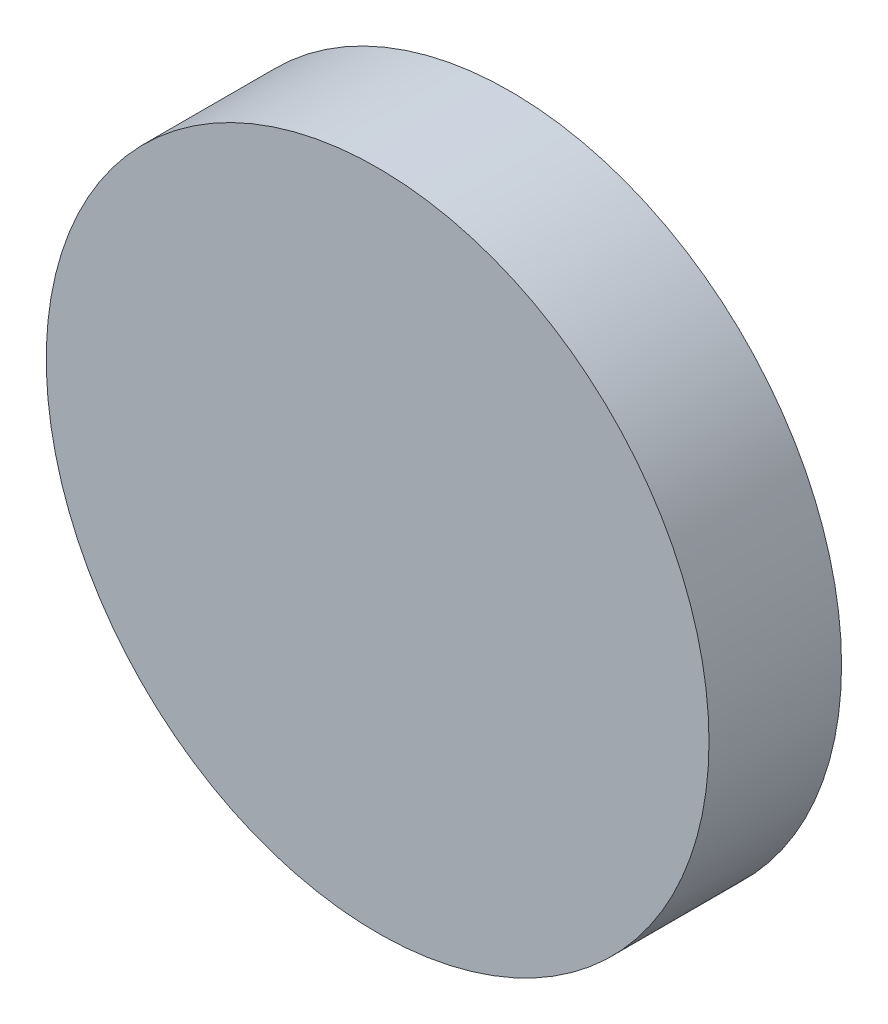
from build123d import *

# Parameters (mm, degrees)
STORE_SOG2_KONDENSER_FAN_START = -200
SKETCH1_R                      = 100
STORE_SOG2_KONDENSER_FAN_DEPTH = 40


with BuildPart() as part:
    # Sketch1 → STORE_sog2_kondenser_fan (new body)
    with BuildSketch(Plane.XY.offset(STORE_SOG2_KONDENSER_FAN_START)):
        with Locations((1090, 1805)):
            Circle(SKETCH1_R)
    extrude(amount=-STORE_SOG2_KONDENSER_FAN_DEPTH)


solid = part.part
